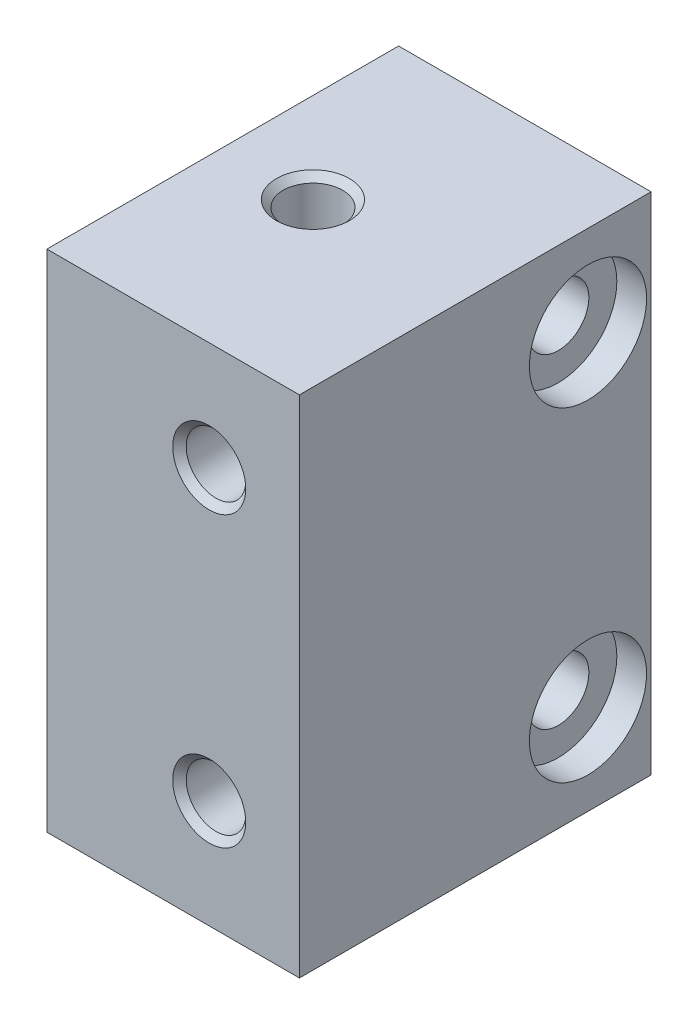
from build123d import *

# Parameters (mm, degrees)
ESQUISSE1_W                                      = 14
ESQUISSE1_H                                      = 28
BOSS_EXTRU_1_DEPTH                               = 19.5
CHAMBRAGE_POUR_VIS_T_TE_RONDE_6_PANS_D           = 3.4
CHAMBRAGE_POUR_VIS_T_TE_RONDE_6_PANS_CBORE_D     = 6.5
CHAMBRAGE_POUR_VIS_T_TE_RONDE_6_PANS_CBORE_DEPTH = 1.65
TROU_TARAUD_M4X0_72_D                            = 3.3
TROU_TARAUD_M4X0_72_DEPTH                        = 11.5
TROU_TARAUD_M4X0_72_CSINK_D                      = 4.05
TROU_TARAUD_M4X0_72_CSINK_ANGLE                  = 90
TROU_TARAUD_M4X0_72_TIP                          = 0.991420021


with BuildPart() as part:
    # Esquisse1 → Boss.-Extru.1 (new body)
    with BuildSketch(Plane.XY):
        with Locations((14.905012229, -0.00220912)):
            Rectangle(ESQUISSE1_W, ESQUISSE1_H)
    extrude(amount=BOSS_EXTRU_1_DEPTH)

    # Chambrage pour Vis à tête ronde à 6 pans creux M31 (through all)
    with Locations(Plane(origin=(21.905012229, 0, 0), x_dir=(0, 0, -1), z_dir=(1, 0, 0))):
        with Locations((-3.5, 8.99779088), (-3.5, -9.00220912)):
            CounterBoreHole(CHAMBRAGE_POUR_VIS_T_TE_RONDE_6_PANS_D / 2, CHAMBRAGE_POUR_VIS_T_TE_RONDE_6_PANS_CBORE_D / 2, CHAMBRAGE_POUR_VIS_T_TE_RONDE_6_PANS_CBORE_DEPTH)

    # Trou taraudé M4x0.72
    with Locations(Plane.XY.offset(19.5)):
        with Locations((16.905012229, 7.99779088), (16.905012229, -8.00220912)):
            CounterSinkHole(TROU_TARAUD_M4X0_72_D / 2, TROU_TARAUD_M4X0_72_CSINK_D / 2, depth=TROU_TARAUD_M4X0_72_DEPTH, counter_sink_angle=TROU_TARAUD_M4X0_72_CSINK_ANGLE)
            with Locations((0, 0, -(TROU_TARAUD_M4X0_72_DEPTH + TROU_TARAUD_M4X0_72_TIP / 2))):  # 118° drill point
                Cone(0, TROU_TARAUD_M4X0_72_D / 2, TROU_TARAUD_M4X0_72_TIP, mode=Mode.SUBTRACT)

    # Esquisse15 → Trou taraudé M4x0.73 (revolve, cut)
    with BuildSketch(Plane(origin=(12.905012229, 13.99779088, 9.75), x_dir=(0, 0, 1), z_dir=(1, 0, 0))):
        Polygon((0, 0), (0, 28), (2.025, 28), (1.65, 27.625), (1.65, 0.375), (2.025, 0), align=None)
    revolve(axis=Axis((12.905012229, 20.34779088, 9.75), (0, -1, 0)), mode=Mode.SUBTRACT)


solid = part.part
